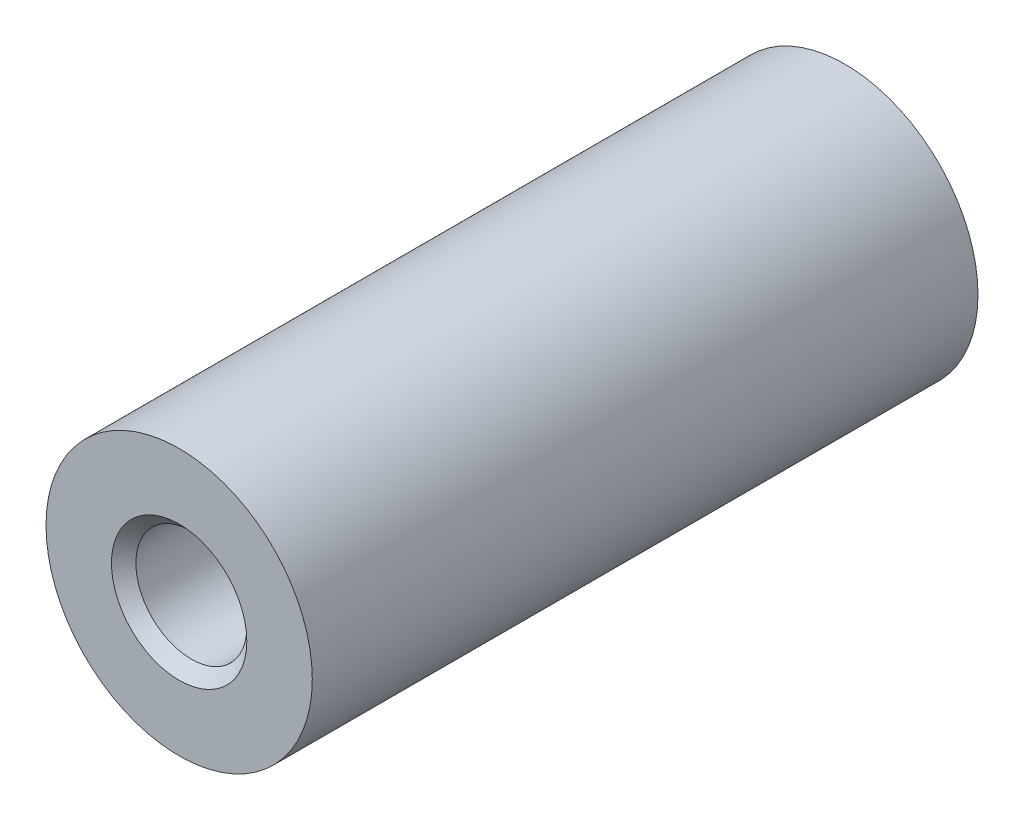
from build123d import *

# Parameters (mm, degrees)
SKETCH_1_R                   = 3
EXTRUDE_1_DEPTH              = 15
HOLE_WIZARD_M3_1_D           = 2.5
HOLE_WIZARD_M3_1_CSINK_D     = 3.05
HOLE_WIZARD_M3_1_CSINK_ANGLE = 90


with BuildPart() as part:
    # 草图1 → 凸台-拉伸1 (new body)
    with BuildSketch(Plane.XY):
        Circle(SKETCH_1_R)
    extrude(amount=EXTRUDE_1_DEPTH)

    # M3 螺纹孔1 (through all)
    with Locations(Plane.XY.offset(15)):
        with Locations((0, 0)):
            CounterSinkHole(HOLE_WIZARD_M3_1_D / 2, HOLE_WIZARD_M3_1_CSINK_D / 2, counter_sink_angle=HOLE_WIZARD_M3_1_CSINK_ANGLE)


solid = part.part
